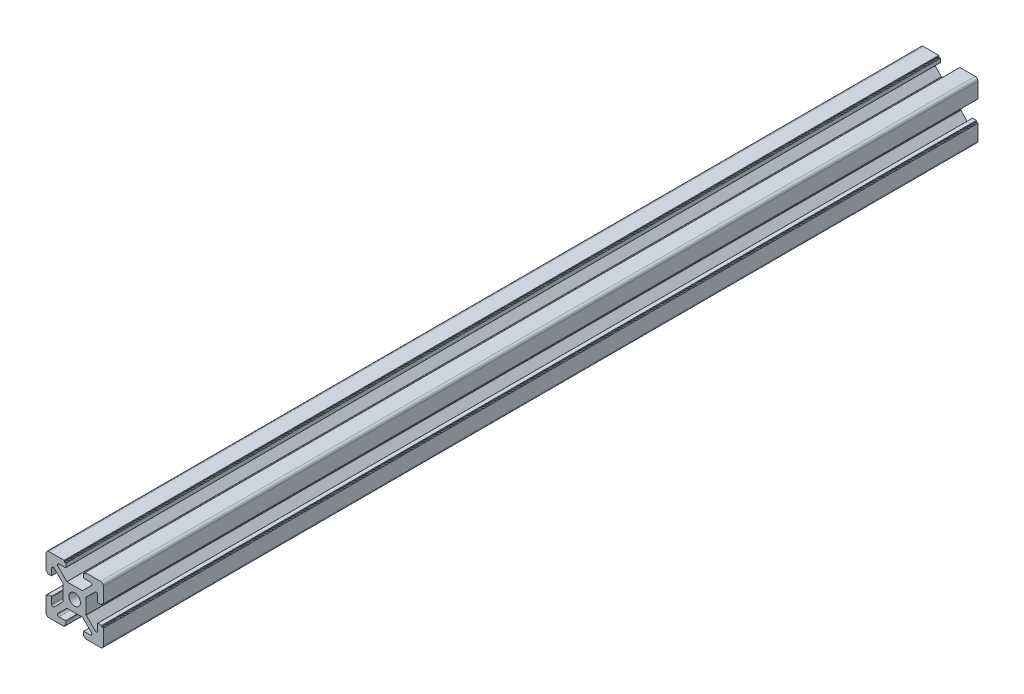
from build123d import *

# Parameters (mm, degrees)
SKETCH1_R           = 2
BOSS_EXTRUDE1_DEPTH = 305


with BuildPart() as part:
    # Sketch1 → Boss-Extrude1 (new body)
    with BuildSketch(Plane.XY):
        with BuildLine():
            Line((-10, 9), (-10, 3.7))
            ThreePointArc((-10, 3.7), (-9.970710678, 3.629289322), (-9.9, 3.6))
            Line((-9.9, 3.6), (-9.6, 3.6))
            ThreePointArc((-9.6, 3.6), (-9.529289322, 3.570710678), (-9.5, 3.5))
            Line((-9.5, 3.5), (-9.5, 3.2))
            ThreePointArc((-9.5, 3.2), (-9.470710678, 3.129289322), (-9.4, 3.1))
            Line((-9.4, 3.1), (-8.1, 3.1))
            ThreePointArc((-8.1, 3.1), (-8.029289322, 3.129289322), (-8, 3.2))
            Line((-8, 3.2), (-8, 5.520101013))
            ThreePointArc((-8, 5.520101013), (-7.691341716, 5.982040779), (-7.146446609, 5.873654403))
            Line((-7.146446609, 5.873654403), (-4.029289322, 2.756497116))
            ThreePointArc((-4.029289322, 2.756497116), (-4.007612047, 2.724054781), (-4, 2.685786438))
            Line((-4, 2.685786438), (-4, 0))
            Line((-4, 0), (-4, -2.685786438))
            ThreePointArc((-4, -2.685786438), (-4.007612047, -2.724054781), (-4.029289322, -2.756497116))
            Line((-4.029289322, -2.756497116), (-7.146446609, -5.873654403))
            ThreePointArc((-7.146446609, -5.873654403), (-7.691341716, -5.982040779), (-8, -5.520101013))
            Line((-8, -5.520101013), (-8, -3.2))
            ThreePointArc((-8, -3.2), (-8.029289322, -3.129289322), (-8.1, -3.1))
            Line((-8.1, -3.1), (-9.4, -3.1))
            ThreePointArc((-9.4, -3.1), (-9.470710678, -3.129289322), (-9.5, -3.2))
            Line((-9.5, -3.2), (-9.5, -3.5))
            ThreePointArc((-9.5, -3.5), (-9.529289322, -3.570710678), (-9.6, -3.6))
            Line((-9.6, -3.6), (-9.9, -3.6))
            ThreePointArc((-9.9, -3.6), (-9.970710678, -3.629289322), (-10, -3.7))
            Line((-10, -3.7), (-10, -9))
            ThreePointArc((-10, -9), (-9.707106781, -9.707106781), (-9, -10))
            Line((-9, -10), (-3.7, -10))
            ThreePointArc((-3.7, -10), (-3.629289322, -9.970710678), (-3.6, -9.9))
            Line((-3.6, -9.9), (-3.6, -9.6))
            ThreePointArc((-3.6, -9.6), (-3.570710678, -9.529289322), (-3.5, -9.5))
            Line((-3.5, -9.5), (-3.2, -9.5))
            ThreePointArc((-3.2, -9.5), (-3.129289322, -9.470710678), (-3.1, -9.4))
            Line((-3.1, -9.4), (-3.1, -8.1))
            ThreePointArc((-3.1, -8.1), (-3.129289322, -8.029289322), (-3.2, -8))
            Line((-3.2, -8), (-5.520101013, -8))
            ThreePointArc((-5.520101013, -8), (-5.982040779, -7.691341716), (-5.873654403, -7.146446609))
            Line((-5.873654403, -7.146446609), (-2.756497116, -4.029289322))
            ThreePointArc((-2.756497116, -4.029289322), (-2.724054781, -4.007612047), (-2.685786438, -4))
            Line((-2.685786438, -4), (2.685786438, -4))
            ThreePointArc((2.685786438, -4), (2.724054781, -4.007612047), (2.756497116, -4.029289322))
            Line((2.756497116, -4.029289322), (5.873654403, -7.146446609))
            ThreePointArc((5.873654403, -7.146446609), (5.982040779, -7.691341716), (5.520101013, -8))
            Line((5.520101013, -8), (3.2, -8))
            ThreePointArc((3.2, -8), (3.129289322, -8.029289322), (3.1, -8.1))
            Line((3.1, -8.1), (3.1, -9.4))
            ThreePointArc((3.1, -9.4), (3.129289322, -9.470710678), (3.2, -9.5))
            Line((3.2, -9.5), (3.5, -9.5))
            ThreePointArc((3.5, -9.5), (3.570710678, -9.529289322), (3.6, -9.6))
            Line((3.6, -9.6), (3.6, -9.9))
            ThreePointArc((3.6, -9.9), (3.629289322, -9.970710678), (3.7, -10))
            Line((3.7, -10), (9, -10))
            ThreePointArc((9, -10), (9.707106781, -9.707106781), (10, -9))
            Line((10, -9), (10, -3.7))
            ThreePointArc((10, -3.7), (9.970710678, -3.629289322), (9.9, -3.6))
            Line((9.9, -3.6), (9.6, -3.6))
            ThreePointArc((9.6, -3.6), (9.529289322, -3.570710678), (9.5, -3.5))
            Line((9.5, -3.5), (9.5, -3.2))
            ThreePointArc((9.5, -3.2), (9.470710678, -3.129289322), (9.4, -3.1))
            Line((9.4, -3.1), (8.1, -3.1))
            ThreePointArc((8.1, -3.1), (8.029289322, -3.129289322), (8, -3.2))
            Line((8, -3.2), (8, -5.520101013))
            ThreePointArc((8, -5.520101013), (7.691341716, -5.982040779), (7.146446609, -5.873654403))
            Line((7.146446609, -5.873654403), (4.029289322, -2.756497116))
            ThreePointArc((4.029289322, -2.756497116), (4.007612047, -2.724054781), (4, -2.685786438))
            Line((4, -2.685786438), (4, 0))
            Line((4, 0), (4, 2.685786438))
            ThreePointArc((4, 2.685786438), (4.007612047, 2.724054781), (4.029289322, 2.756497116))
            Line((4.029289322, 2.756497116), (7.146446609, 5.873654403))
            ThreePointArc((7.146446609, 5.873654403), (7.691341716, 5.982040779), (8, 5.520101013))
            Line((8, 5.520101013), (8, 3.2))
            ThreePointArc((8, 3.2), (8.029289322, 3.129289322), (8.1, 3.1))
            Line((8.1, 3.1), (9.4, 3.1))
            ThreePointArc((9.4, 3.1), (9.470710678, 3.129289322), (9.5, 3.2))
            Line((9.5, 3.2), (9.5, 3.5))
            ThreePointArc((9.5, 3.5), (9.529289322, 3.570710678), (9.6, 3.6))
            Line((9.6, 3.6), (9.9, 3.6))
            ThreePointArc((9.9, 3.6), (9.970710678, 3.629289322), (10, 3.7))
            Line((10, 3.7), (10, 9))
            ThreePointArc((10, 9), (9.707106781, 9.707106781), (9, 10))
            Line((9, 10), (3.7, 10))
            ThreePointArc((3.7, 10), (3.629289322, 9.970710678), (3.6, 9.9))
            Line((3.6, 9.9), (3.6, 9.6))
            ThreePointArc((3.6, 9.6), (3.570710678, 9.529289322), (3.5, 9.5))
            Line((3.5, 9.5), (3.2, 9.5))
            ThreePointArc((3.2, 9.5), (3.129289322, 9.470710678), (3.1, 9.4))
            Line((3.1, 9.4), (3.1, 8.1))
            ThreePointArc((3.1, 8.1), (3.129289322, 8.029289322), (3.2, 8))
            Line((3.2, 8), (5.520101013, 8))
            ThreePointArc((5.520101013, 8), (5.982040779, 7.691341716), (5.873654403, 7.146446609))
            Line((5.873654403, 7.146446609), (2.756497116, 4.029289322))
            ThreePointArc((2.756497116, 4.029289322), (2.724054781, 4.007612047), (2.685786438, 4))
            Line((2.685786438, 4), (-2.685786438, 4))
            ThreePointArc((-2.685786438, 4), (-2.724054781, 4.007612047), (-2.756497116, 4.029289322))
            Line((-2.756497116, 4.029289322), (-5.873654403, 7.146446609))
            ThreePointArc((-5.873654403, 7.146446609), (-5.982040779, 7.691341716), (-5.520101013, 8))
            Line((-5.520101013, 8), (-3.2, 8))
            ThreePointArc((-3.2, 8), (-3.129289322, 8.029289322), (-3.1, 8.1))
            Line((-3.1, 8.1), (-3.1, 9.4))
            ThreePointArc((-3.1, 9.4), (-3.129289322, 9.470710678), (-3.2, 9.5))
            Line((-3.2, 9.5), (-3.5, 9.5))
            ThreePointArc((-3.5, 9.5), (-3.570710678, 9.529289322), (-3.6, 9.6))
            Line((-3.6, 9.6), (-3.6, 9.9))
            ThreePointArc((-3.6, 9.9), (-3.629289322, 9.970710678), (-3.7, 10))
            Line((-3.7, 10), (-9, 10))
            ThreePointArc((-9, 10), (-9.707106781, 9.707106781), (-10, 9))
        make_face()
        Circle(SKETCH1_R, mode=Mode.SUBTRACT)
    extrude(amount=BOSS_EXTRUDE1_DEPTH)


solid = part.part
